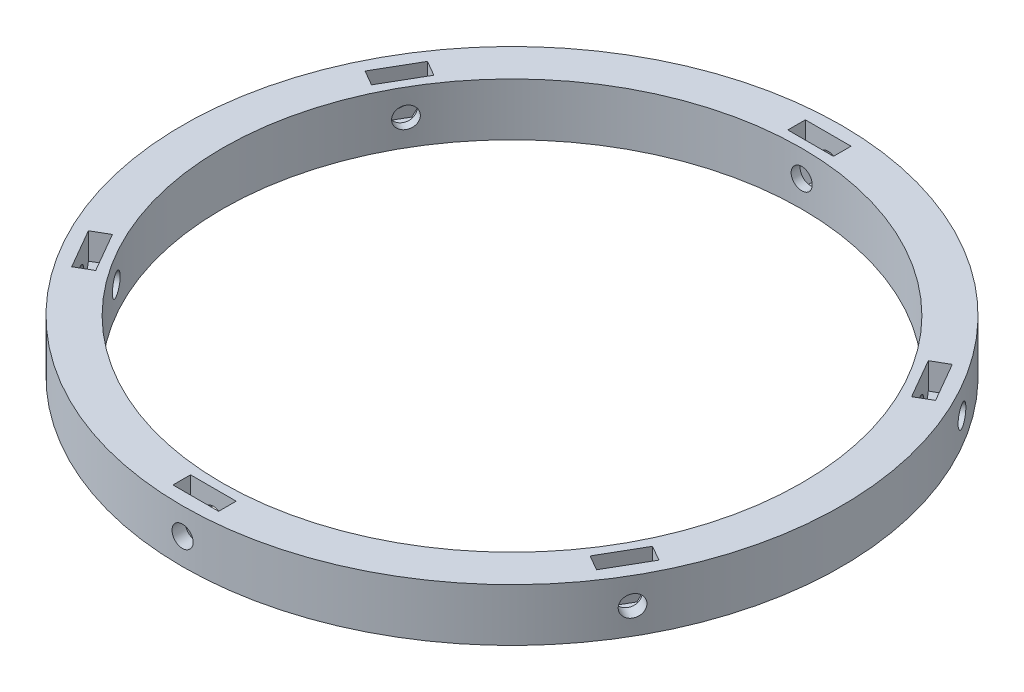
from build123d import *

# Parameters (mm, degrees)
SKETCH2_R           = 47.6504
SKETCH2_R_2         = 41.91
BOSS_EXTRUDE1_DEPTH = 7.62
CUT_EXTRUDE1_DEPTH  = 1.27
SKETCH6_R           = 1.524
CUT_EXTRUDE2_DEPTH  = 6.223
CIRPATTERN1_COUNT   = 6


with BuildPart() as part:
    # Sketch2 → Boss-Extrude1 (new body)
    with BuildSketch(Plane(origin=(0, 0, 0), x_dir=(1, 0, 0), z_dir=(0, 1, 0))):
        with Locations(Location((0, 0, 0), (0, 0, 90))):
            Circle(SKETCH2_R)
        with Locations(Location((0, 0, 0), (0, 0, 90))):
            Circle(SKETCH2_R_2, mode=Mode.SUBTRACT)
    extrude(amount=BOSS_EXTRUDE1_DEPTH)

    # Sketch4 → Cut-Extrude1 (cut, symmetric)
    with BuildSketch(Plane.XY.offset(44.45)):
        Polygon((-1.651, 0.950384117), (0, 0.950384117), (0, 6.669615883), (-1.651, 6.669615883), (-3.302, 3.81), align=None)
        Polygon((0, 6.669615883), (0, 0.950384117), (1.651, 0.950384117), (3.302, 3.81), (1.651, 6.669615883), align=None)
        Polygon((0, 7.62), (0, 6.669615883), (1.651, 6.669615883), (3.302, 3.81), (3.302, 7.62), align=None)
        Polygon((-1.651, 6.669615883), (0, 6.669615883), (0, 7.62), (-3.302, 7.62), (-3.302, 3.81), align=None)
    cut_extrude1 = extrude(amount=CUT_EXTRUDE1_DEPTH, both=True, mode=Mode.SUBTRACT)

    # Sketch6 → Cut-Extrude2 (cut, symmetric)
    with BuildSketch(Plane.XY.offset(44.45)):
        with Locations((0, 3.81)):
            Circle(SKETCH6_R)
    cut_extrude2 = extrude(amount=CUT_EXTRUDE2_DEPTH, both=True, mode=Mode.SUBTRACT)

    # CirPattern1: Cut-Extrude1, Cut-Extrude2 ×6 about axis
    cirpattern1_axis = Axis((0, 0, 0), (0, 1, 0))
    add([cut_extrude1.rotate(cirpattern1_axis, i * 360 / CIRPATTERN1_COUNT) for i in range(1, CIRPATTERN1_COUNT)], mode=Mode.SUBTRACT)
    add([cut_extrude2.rotate(cirpattern1_axis, i * 360 / CIRPATTERN1_COUNT) for i in range(1, CIRPATTERN1_COUNT)], mode=Mode.SUBTRACT)


solid = part.part
